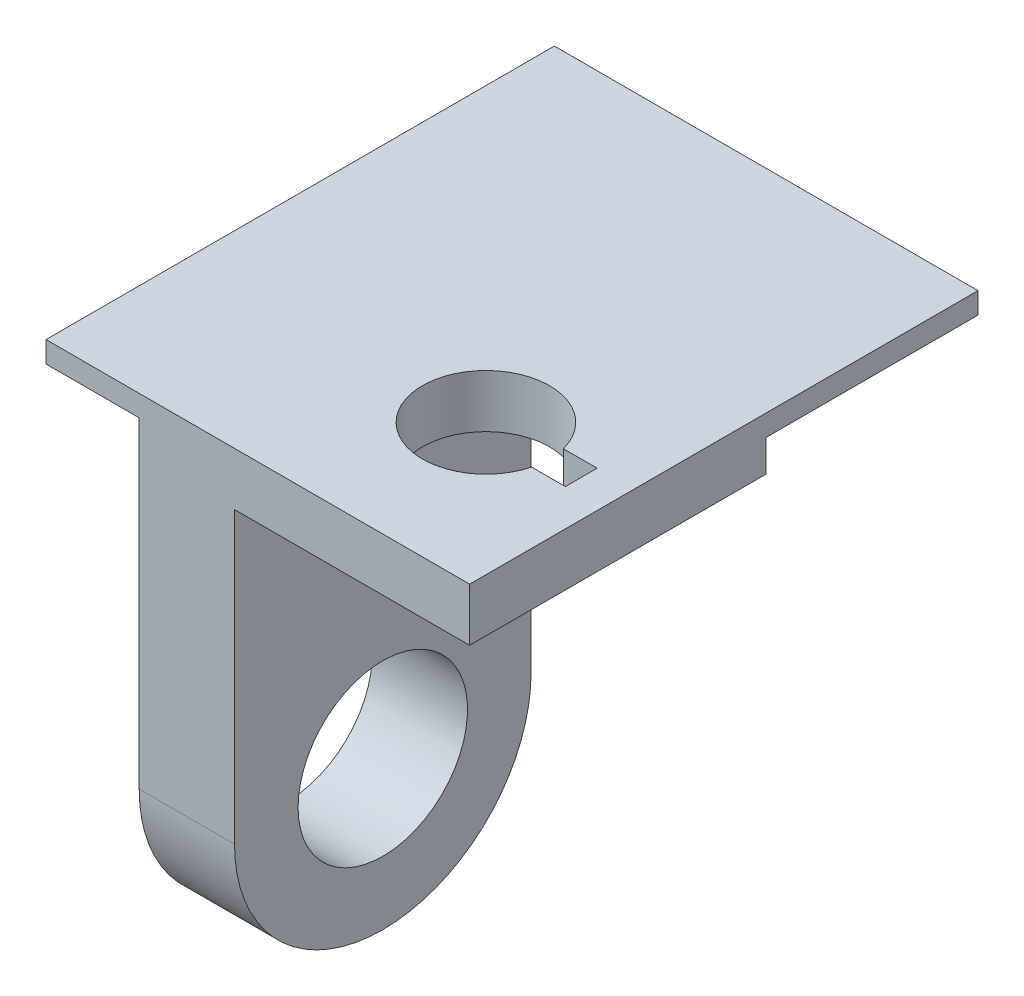
from build123d import *

# Parameters (mm, degrees)
SCHIZZO1_R                   = 40
ESTRUSIONE_ESTRUSIONE1_DEPTH = 45
SCHIZZO2_W                   = 156
SCHIZZO2_H                   = 140
SCHIZZO2_R                   = 30
ESTRUSIONE_ESTRUSIONE2_DEPTH = 25
ESTRUSIONE_ESTRUSIONE4_DEPTH = 10
SCHIZZO6_W                   = 45
SCHIZZO6_H                   = 15
TAGLIO_ESTRUSIONE1_DEPTH     = 25


with BuildPart() as part:
    # Schizzo1 → Estrusione-Estrusione1 (new body)
    with BuildSketch(Plane(origin=(0, 0, 0), x_dir=(0, 0, -1), z_dir=(1, 0, 0))):
        with BuildLine():
            Line((-70, 0), (-70, 136.8))
            Line((-70, 136.8), (70, 136.8))
            Line((70, 136.8), (70, 0))
            ThreePointArc((70, 0), (0, -70), (-70, 0))
        make_face()
        with Locations(Location((0, 0, 0), (0, 0, 180))):
            Circle(SCHIZZO1_R, mode=Mode.SUBTRACT)
    extrude(amount=ESTRUSIONE_ESTRUSIONE1_DEPTH)

    # Schizzo2 → Estrusione-Estrusione2 (add)
    with BuildSketch(Plane(origin=(0, 136.8, 0), x_dir=(1, 0, 0), z_dir=(0, 1, 0))):
        with Locations((78, 0)):
            Rectangle(SCHIZZO2_W, SCHIZZO2_H)
        with Locations(Location((93.7, 0, 0), (0, 0, 270))):
            Circle(SCHIZZO2_R, mode=Mode.SUBTRACT)
    extrude(amount=ESTRUSIONE_ESTRUSIONE2_DEPTH)

    # Schizzo5 → Estrusione-Estrusione4 (add)
    with BuildSketch(Plane(origin=(0, 161.8, 0), x_dir=(1, 0, 0), z_dir=(0, 1, 0))):
        Polygon((156, 170), (156, 70), (0, 70), (0, -70), (-44, -70), (-44, 170), align=None)
    extrude(amount=-ESTRUSIONE_ESTRUSIONE4_DEPTH)

    # Schizzo6 → Taglio-Estrusione1 (cut)
    with BuildSketch(Plane(origin=(0, 161.8, 0), x_dir=(1, 0, 0), z_dir=(0, 1, 0))):
        with Locations((116.2, 0)):
            Rectangle(SCHIZZO6_W, SCHIZZO6_H)
    extrude(amount=-TAGLIO_ESTRUSIONE1_DEPTH, mode=Mode.SUBTRACT)


solid = part.part
